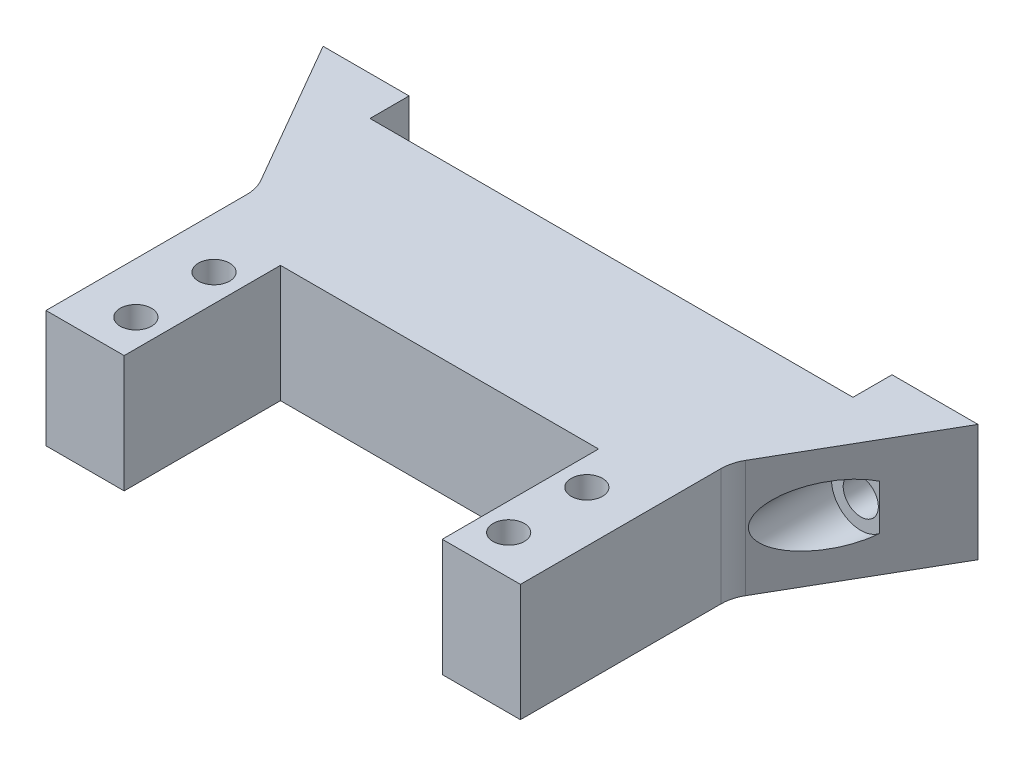
from build123d import *

# Parameters (mm, degrees)
SKETCH1_R           = 2
BOSS_EXTRUDE1_DEPTH = 15
SKETCH2_R           = 2.25
CUT_EXTRUDE1_DEPTH  = 8
SKETCH3_R           = 3.75
CUT_EXTRUDE2_DEPTH  = 60.172282871
SKETCH4_W           = 61.794010768
SKETCH4_H           = 5
CUT_EXTRUDE3_DEPTH  = 58.873647372


with BuildPart() as part:
    # Sketch1 → Boss-Extrude1 (new body)
    with BuildSketch(Plane(origin=(0, 0, 0), x_dir=(-1, 0, 0), z_dir=(0, 1, 0))):
        with BuildLine():
            Line((20.35, 10), (20.35, -10))
            Line((20.35, -10), (-20.35, -10))
            Line((-20.35, -10), (-20.35, 10))
            Line((-20.35, 10), (-30.35, 10))
            Line((-30.35, 10), (-30.35, -15.660254038))
            ThreePointArc((-30.35, -15.660254038), (-30.520370869, -16.954349263), (-31.019872981, -18.160254038))
            Line((-31.019872981, -18.160254038), (-41.897005384, -37))
            Line((-41.897005384, -37), (41.897005384, -37))
            Line((41.897005384, -37), (31.019872981, -18.160254038))
            ThreePointArc((31.019872981, -18.160254038), (30.520370869, -16.954349263), (30.35, -15.660254038))
            Line((30.35, -15.660254038), (30.35, 10))
            Line((30.35, 10), (20.35, 10))
        make_face()
        with Locations(Location((23.85, -5, 0), (0, 0, 90))):
            Circle(SKETCH1_R, mode=Mode.SUBTRACT)
        with Locations(Location((23.85, 5, 0), (0, 0, 90))):
            Circle(SKETCH1_R, mode=Mode.SUBTRACT)
        with Locations(Location((-23.85, -5, 0), (0, 0, 270))):
            Circle(SKETCH1_R, mode=Mode.SUBTRACT)
        with Locations(Location((-23.85, 5, 0), (0, 0, 270))):
            Circle(SKETCH1_R, mode=Mode.SUBTRACT)
    extrude(amount=-BOSS_EXTRUDE1_DEPTH)

    # Sketch2 → Cut-Extrude1 (cut)
    with BuildSketch(Plane(origin=(0, 0, -37), x_dir=(1, 0, 0), z_dir=(0, 0, -1))):
        with Locations(Location((-34.897005384, 7.5, 0), (0, 0, 180))):
            Circle(SKETCH2_R)
        with Locations((34.897005384, 7.5)):
            Circle(SKETCH2_R)
    extrude(amount=-CUT_EXTRUDE1_DEPTH, mode=Mode.SUBTRACT)

    # Sketch3 → Cut-Extrude2 (cut, through all)
    with BuildSketch(Plane(origin=(0, 0, -29), x_dir=(-1, 0, 0), z_dir=(0, 0, -1))):
        with Locations((-34.897005384, -7.5)):
            Circle(SKETCH3_R)
        with Locations((34.897005384, -7.5)):
            Circle(SKETCH3_R)
    extrude(amount=-CUT_EXTRUDE2_DEPTH, mode=Mode.SUBTRACT)

    # Sketch4 → Cut-Extrude3 (cut, through all)
    with BuildSketch(Plane.XZ.offset(15)):
        with Locations((0, -34.5)):
            Rectangle(SKETCH4_W, SKETCH4_H)
    extrude(amount=-CUT_EXTRUDE3_DEPTH, mode=Mode.SUBTRACT)


solid = part.part
